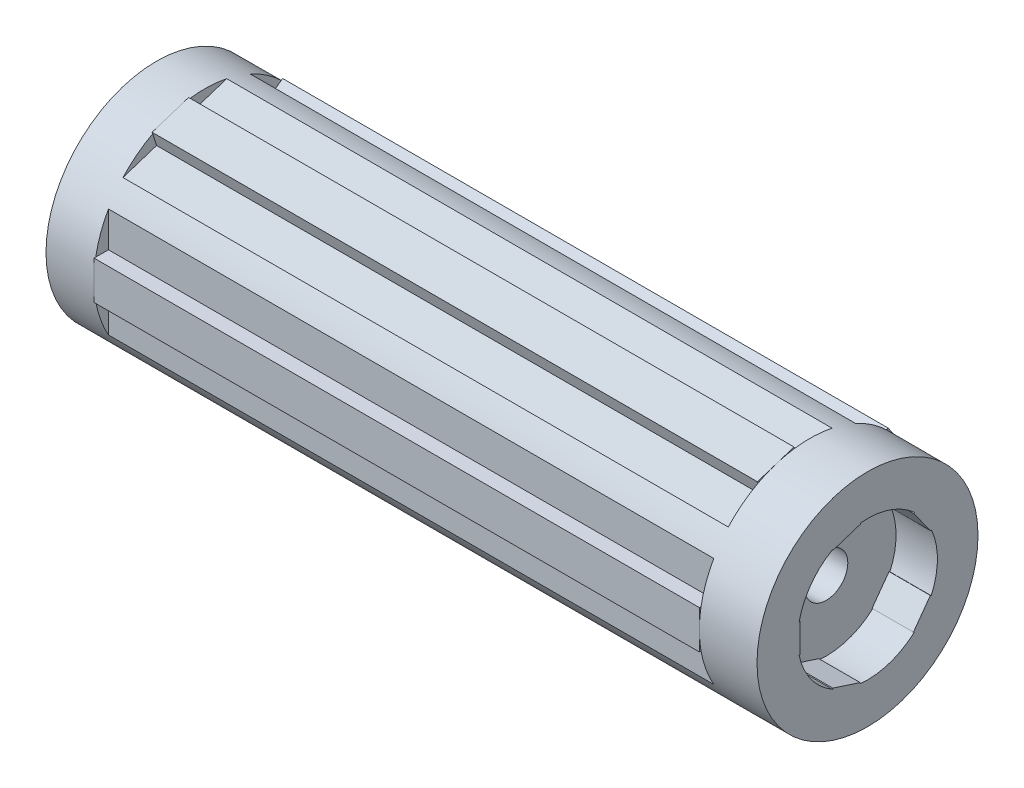
from build123d import *

# Parameters (mm, degrees)
SKIZZE1_R                                 = 11.5
GRUNDK_RPER_WALZE_DEPTH                   = 74
PRESSPASSUNG_KUGELLAGER_DEPTH             = 4.3
SKIZZE3_R                                 = 2.25
M4_SCHRAUBENF_HRUNG_DEPTH                 = 4.5
SKIZZE4_R                                 = 9.675
MOTORAUSSPARUNG_DEPTH                     = 12.75
ZERST_RUNGSELEMENT_START                  = -6
SKIZZE7_W                                 = 1.5
SKIZZE7_H                                 = 15
ZERST_RUNGSELEMENT_AUSSPARUNG_DEPTH       = 63
SKIZZE8_W                                 = 63
SKIZZE8_H                                 = 4
ZERST_RUNGSELEMENT_RECHTECK_DEPTH         = 1.5
M5_MOTOR_MUTTER_DEPTH                     = 12
SKIZZE12_R                                = 3.1
M5_AUSLAUF_SCHRAUBE_DEPTH                 = 2
ZERST_RUNGSELEMENT_VERVIELF_LTIGUNG_COUNT = 5
FASE1_SIZE                                = 0.4


with BuildPart() as part:
    # Skizze1 → Grundkörper Walze (new body)
    with BuildSketch(Plane(origin=(0, 0, 0), x_dir=(0, 0, -1), z_dir=(1, 0, 0))):
        Circle(SKIZZE1_R)
    extrude(amount=GRUNDK_RPER_WALZE_DEPTH)

    # Skizze2 → Presspassung Kugellager (cut)
    with BuildSketch(Plane(origin=(74, 0, 0), x_dir=(0, 0, -1), z_dir=(1, 0, 0))):
        with BuildLine():
            Line((-7.1137911, 1.5230237), (-7.0137911, 1.5230237))
            Line((-7.0137911, 1.5230237), (-7.0137911, -1.4769763))
            Line((-7.0137911, -1.4769763), (-7.123493947, -1.4769763))
            ThreePointArc((-7.123493947, -1.4769763), (-5.899398016, -4.257079756), (-3.646763959, -6.294977175))
            Line((-3.646763959, -6.294977175), (-3.61586226, -6.199871523))
            Line((-3.61586226, -6.199871523), (-0.762692711, -7.126922506))
            Line((-0.762692711, -7.126922506), (-0.796592755, -7.231256114))
            ThreePointArc((-0.796592755, -7.231256114), (2.225709199, -6.926170916), (4.859967024, -5.413533553))
            Line((4.859967024, -5.413533553), (4.779065325, -5.354755027))
            Line((4.779065325, -5.354755027), (6.542421081, -2.927704044))
            Line((6.542421081, -2.927704044), (6.631172549, -2.99218576))
            ThreePointArc((6.631172549, -2.99218576), (7.27496195, -0.023529282), (6.650388764, 2.94922944))
            Line((6.650388764, 2.94922944), (6.569487065, 2.890450915))
            Line((6.569487065, 2.890450915), (4.806131308, 5.317501898))
            Line((4.806131308, 5.317501898), (4.894882775, 5.381983613))
            ThreePointArc((4.894882775, 5.381983613), (2.270464553, 6.91162902), (-0.749800729, 7.236257587))
            Line((-0.749800729, 7.236257587), (-0.71889903, 7.141151935))
            Line((-0.71889903, 7.141151935), (-3.572068579, 6.214100952))
            Line((-3.572068579, 6.214100952), (-3.605968623, 6.31843456))
            ThreePointArc((-3.605968623, 6.31843456), (-5.871737686, 4.295150934), (-7.1137911, 1.5230237))
        make_face()
    extrude(amount=-PRESSPASSUNG_KUGELLAGER_DEPTH, mode=Mode.SUBTRACT)

    # Skizze3 → M4 Schraubenführung (cut)
    with BuildSketch(Plane(origin=(69.7, 0, 0), x_dir=(0, 0, -1), z_dir=(1, 0, 0))):
        Circle(SKIZZE3_R)
    extrude(amount=-M4_SCHRAUBENF_HRUNG_DEPTH, mode=Mode.SUBTRACT)

    # Skizze4 → Motoraussparung (cut)
    with BuildSketch(Plane.ZY):
        Circle(SKIZZE4_R)
    extrude(amount=-MOTORAUSSPARUNG_DEPTH, mode=Mode.SUBTRACT)

    # Skizze7 → Zerstörungselement Aussparung (cut)
    with BuildSketch(Plane(origin=(74, 0, 0), x_dir=(0, 0, -1), z_dir=(1, 0, 0)).offset(ZERST_RUNGSELEMENT_START)):
        with Locations((-10.75, 0)):
            Rectangle(SKIZZE7_W, SKIZZE7_H)
    zerst_rungselement_aussparung = extrude(amount=-ZERST_RUNGSELEMENT_AUSSPARUNG_DEPTH, mode=Mode.SUBTRACT)

    # Skizze8 → Zerstörungselement Rechteck (add)
    with BuildSketch(Plane.XY.offset(10)):
        with Locations((36.5, 0)):
            Rectangle(SKIZZE8_W, SKIZZE8_H)
    zerst_rungselement_rechteck = extrude(amount=ZERST_RUNGSELEMENT_RECHTECK_DEPTH)

    # Skizze10 → M5 Motor Mutter (cut)
    with BuildSketch(Plane.ZY.offset(-12.75)):
        Polygon((4.139835299, -2.29675794), (4.058968371, 2.436823566), (-0.080866927, 4.733581506), (-4.139835299, 2.29675794), (-4.058968371, -2.436823566), (0.080866927, -4.733581506), align=None)
    extrude(amount=-M5_MOTOR_MUTTER_DEPTH, mode=Mode.SUBTRACT)

    # Skizze12 → M5 Auslauf Schraube (cut)
    with BuildSketch(Plane.ZY.offset(-24.75)):
        Circle(SKIZZE12_R)
    extrude(amount=-M5_AUSLAUF_SCHRAUBE_DEPTH, mode=Mode.SUBTRACT)

    # Zerstörungselement Vervielfältigung: Zerstörungselement Aussparung, Zerstörungselement Rechteck ×5 about axis
    zerst_rungselement_vervielf_ltigung_axis = Axis((0, 0, 0), (1, 0, 0))
    add([zerst_rungselement_aussparung.rotate(zerst_rungselement_vervielf_ltigung_axis, i * 360 / ZERST_RUNGSELEMENT_VERVIELF_LTIGUNG_COUNT) for i in range(1, ZERST_RUNGSELEMENT_VERVIELF_LTIGUNG_COUNT)], mode=Mode.SUBTRACT)
    add([zerst_rungselement_rechteck.rotate(zerst_rungselement_vervielf_ltigung_axis, i * 360 / ZERST_RUNGSELEMENT_VERVIELF_LTIGUNG_COUNT) for i in range(1, ZERST_RUNGSELEMENT_VERVIELF_LTIGUNG_COUNT)])

    # Skizze15 → Innenaussparung (revolve, cut)
    with BuildSketch(Plane.XY, mode=Mode.PRIVATE) as innenaussparung_sk:
        Polygon((27.25, 0), (35.75, 8.5), (65.2, 8.5), (65.2, 0), align=None)
    revolve(innenaussparung_sk.sketch.rotate(Axis((-6.893942049, 0, 0), (1, 0, 0)), 90), axis=Axis((-6.893942049, 0, 0), (1, 0, 0)), mode=Mode.SUBTRACT)

    # Fase1
    fase1_edges = [part.edges().sort_by_distance(p)[0] for p in [
        (0, 0, -9.675),
    ]]
    chamfer(fase1_edges, length=FASE1_SIZE)


solid = part.part
